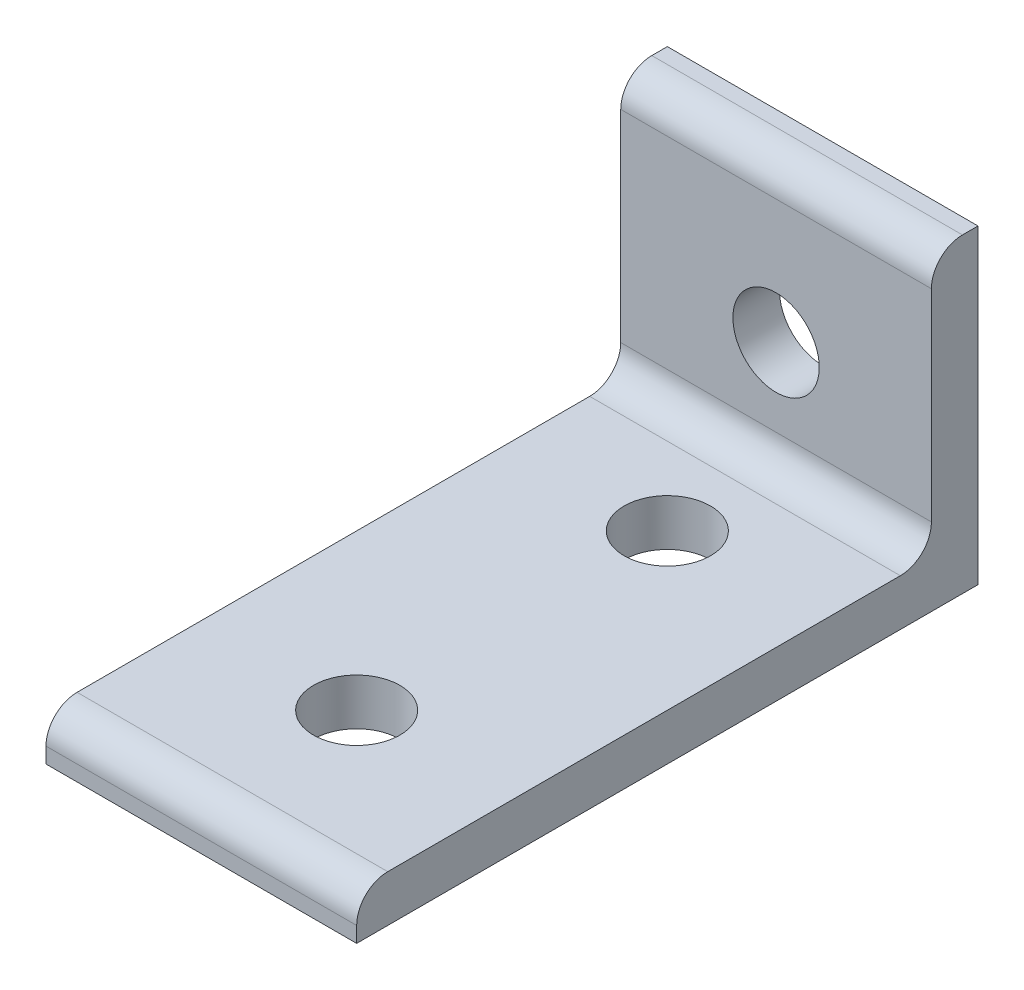
from build123d import *

# Parameters (mm, degrees)
BOSS_EXTRUDE1_DEPTH     = 10
CUT_EXTRUDE1_DEPTH      = 43.426406871
CUT_EXTRUDE1_DEPTH_BACK = 43.426406871
SKETCH2_R               = 2.78
CUT_EXTRUDE2_DEPTH      = 31
CUT_EXTRUDE2_DEPTH_BACK = 31
SKETCH3_R               = 2.78


with BuildPart() as part:
    # Sketch1 → Boss-Extrude1 (new, symmetric)
    with BuildSketch(Plane(origin=(0, 0, 0), x_dir=(0, 0, -1), z_dir=(1, 0, 0))):
        with BuildLine():
            Line((-20, -10), (20, -10))
            Line((20, -10), (20, 10))
            Line((20, 10), (19, 10))
            ThreePointArc((19, 10), (17.585786438, 9.414213562), (17, 8))
            Line((17, 8), (17, -5))
            ThreePointArc((17, -5), (16.414213562, -6.414213562), (15, -7))
            Line((15, -7), (-18, -7))
            ThreePointArc((-18, -7), (-19.414213562, -7.585786438), (-20, -9))
            Line((-20, -9), (-20, -10))
        make_face()
    extrude(amount=BOSS_EXTRUDE1_DEPTH, both=True)

    # Sketch2 → Cut-Extrude1 (cut, two sides: drawn at the far end of the back side and taken through both)
    with BuildSketch(Plane(origin=(0, 0, -20), x_dir=(-1, 0, 0), z_dir=(0, 0, -1)).offset(-CUT_EXTRUDE1_DEPTH_BACK)):
        with Locations(Location((0, 0, 0), (0, 0, 90))):
            Circle(SKETCH2_R)
    extrude(amount=CUT_EXTRUDE1_DEPTH + CUT_EXTRUDE1_DEPTH_BACK, mode=Mode.SUBTRACT)

    # Sketch3 → Cut-Extrude2 (cut, two sides: drawn at the far end of the back side and taken through both)
    with BuildSketch(Plane.XZ.offset(10).offset(-CUT_EXTRUDE2_DEPTH_BACK)):
        with Locations(Location((0, 10, 0), (0, 0, 270))):
            Circle(SKETCH3_R)
        with Locations(Location((0, -10, 0), (0, 0, 270))):
            Circle(SKETCH3_R)
    extrude(amount=CUT_EXTRUDE2_DEPTH + CUT_EXTRUDE2_DEPTH_BACK, mode=Mode.SUBTRACT)


solid = part.part
